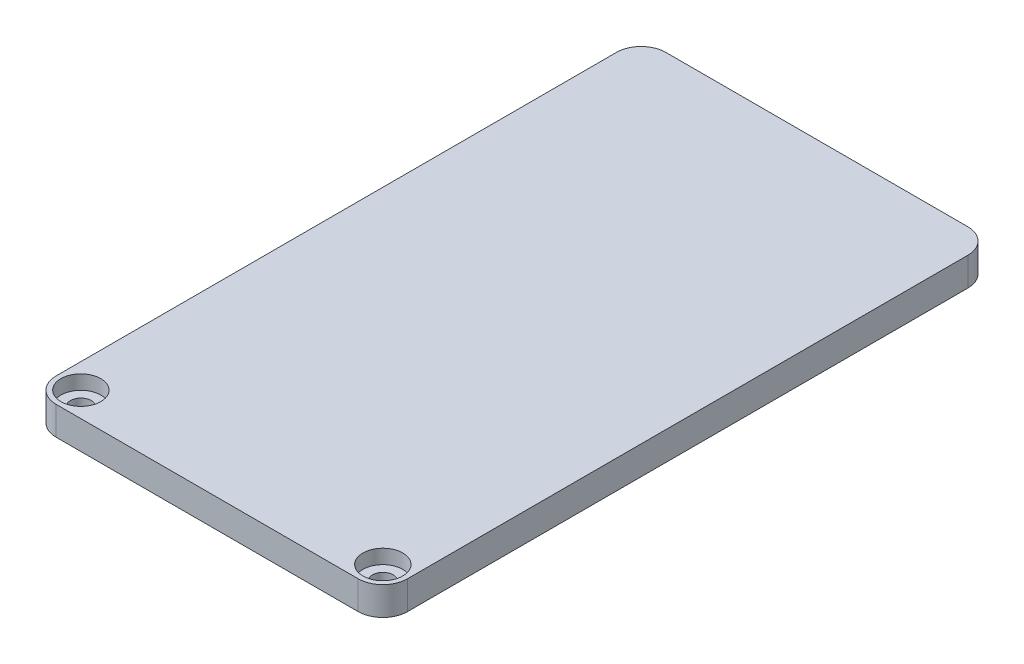
from build123d import *

# Parameters (mm, degrees)
SZKIC1_W                    = 37
SZKIC1_H                    = 64.2
DODANIE_WYCI_GNI_CIE1_DEPTH = 3
ZAOKR_GLENIE1_R             = 2.6
SZKIC2_R                    = 1.1
WYTNIJ_WYCI_GNI_CIE1_DEPTH  = 38.170687376
SZKIC3_R                    = 2.1
WYTNIJ_WYCI_GNI_CIE2_DEPTH  = 1.5


with BuildPart() as part:
    # Szkic1 → Dodanie-wyciągnięcie1 (new body)
    with BuildSketch(Plane(origin=(0, 0, 0), x_dir=(1, 0, 0), z_dir=(0, 1, 0))):
        Rectangle(SZKIC1_W, SZKIC1_H)
    extrude(amount=DODANIE_WYCI_GNI_CIE1_DEPTH)

    # Zaokrąglenie1
    zaokr_glenie1_edges = [part.edges().sort_by_distance(p)[0] for p in [
        (18.5, 1.5, 32.1),
        (-18.5, 1.5, 32.1),
        (-18.5, 1.5, -32.1),
        (18.5, 1.5, -32.1),
    ]]
    fillet(zaokr_glenie1_edges, radius=ZAOKR_GLENIE1_R)

    # Szkic2 → Wytnij-wyciągnięcie1 (cut, through all)
    with BuildSketch(Plane(origin=(0, 3, 0), x_dir=(1, 0, 0), z_dir=(0, 1, 0))):
        with Locations(Location((15.9, -29.5, 0), (0, 0, 270))):
            Circle(SZKIC2_R)
        with Locations(Location((-15.9, -29.5, 0), (0, 0, 270))):
            Circle(SZKIC2_R)
    extrude(amount=-WYTNIJ_WYCI_GNI_CIE1_DEPTH, mode=Mode.SUBTRACT)

    # Szkic3 → Wytnij-wyciągnięcie2 (cut)
    with BuildSketch(Plane(origin=(0, 3, 0), x_dir=(1, 0, 0), z_dir=(0, 1, 0))):
        with Locations(Location((-15.9, -29.5, 0), (0, 0, 270))):
            Circle(SZKIC3_R)
        with Locations(Location((15.9, -29.5, 0), (0, 0, 270))):
            Circle(SZKIC3_R)
    extrude(amount=-WYTNIJ_WYCI_GNI_CIE2_DEPTH, mode=Mode.SUBTRACT)


solid = part.part
